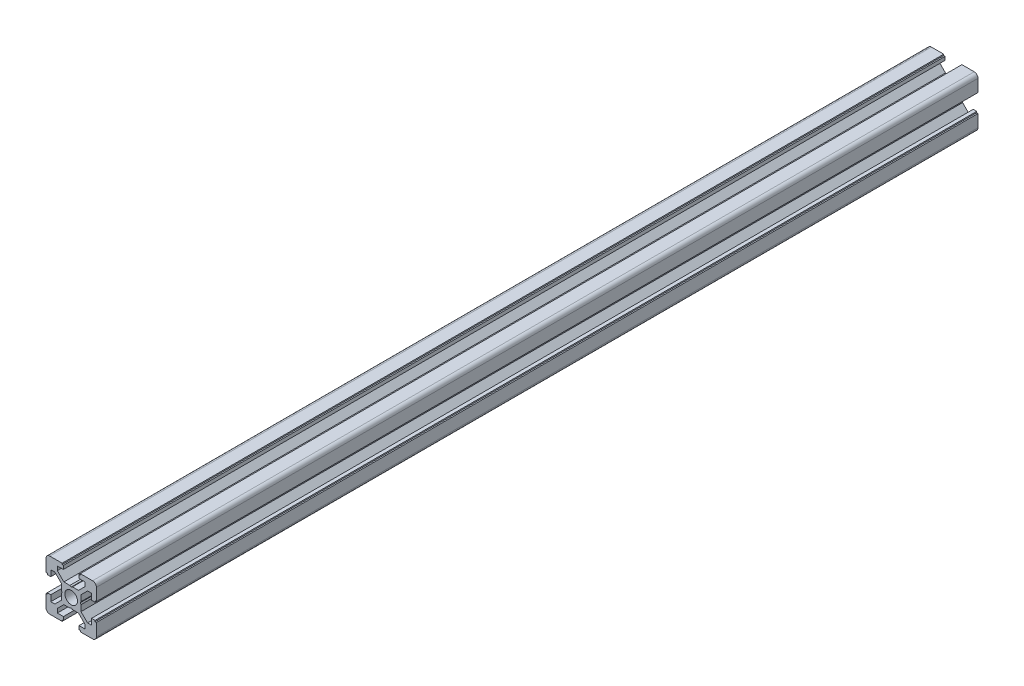
from build123d import *

# Parameters (mm, degrees)
SKETCH_28_R     = 2.5
EXTRUDE_1_DEPTH = 350


with BuildPart() as part:
    # 草图28 → 凸台-拉伸1 (new body)
    with BuildSketch(Plane.XY):
        with BuildLine():
            Line((-3.9, -0.519615242), (-3.9, -2.910050506))
            Line((-3.9, -2.910050506), (-6.489949494, -5.5))
            Line((-6.489949494, -5.5), (-8.1, -5.5))
            Line((-8.1, -5.5), (-8.1, -3.1))
            Line((-8.1, -3.1), (-9.5, -3.1))
            Line((-9.5, -3.1), (-9.5, -3.6))
            Line((-9.5, -3.6), (-10, -3.6))
            Line((-10, -3.6), (-10, -8.5))
            ThreePointArc((-10, -8.5), (-9.560660172, -9.560660172), (-8.5, -10))
            Line((-8.5, -10), (-3.6, -10))
            Line((-3.6, -10), (-3.6, -9.5))
            Line((-3.6, -9.5), (-3.1, -9.5))
            Line((-3.1, -9.5), (-3.1, -8.1))
            Line((-3.1, -8.1), (-5.5, -8.1))
            Line((-5.5, -8.1), (-5.5, -6.489949494))
            Line((-5.5, -6.489949494), (-2.910050506, -3.9))
            Line((-2.910050506, -3.9), (-0.519615242, -3.9))
            Line((-0.519615242, -3.9), (0, -3.6))
            Line((0, -3.6), (0.519615242, -3.9))
            Line((0.519615242, -3.9), (2.910050506, -3.9))
            Line((2.910050506, -3.9), (5.5, -6.489949494))
            Line((5.5, -6.489949494), (5.5, -8.1))
            Line((5.5, -8.1), (3.1, -8.1))
            Line((3.1, -8.1), (3.1, -9.5))
            Line((3.1, -9.5), (3.6, -9.5))
            Line((3.6, -9.5), (3.6, -10))
            Line((3.6, -10), (8.5, -10))
            ThreePointArc((8.5, -10), (9.560660172, -9.560660172), (10, -8.5))
            Line((10, -8.5), (10, -3.6))
            Line((10, -3.6), (9.5, -3.6))
            Line((9.5, -3.6), (9.5, -3.1))
            Line((9.5, -3.1), (8.1, -3.1))
            Line((8.1, -3.1), (8.1, -5.5))
            Line((8.1, -5.5), (6.489949494, -5.5))
            Line((6.489949494, -5.5), (3.9, -2.910050506))
            Line((3.9, -2.910050506), (3.9, -0.519615242))
            Line((3.9, -0.519615242), (3.6, 0))
            Line((3.6, 0), (3.9, 0.519615242))
            Line((3.9, 0.519615242), (3.9, 2.910050506))
            Line((3.9, 2.910050506), (6.489949494, 5.5))
            Line((6.489949494, 5.5), (8.1, 5.5))
            Line((8.1, 5.5), (8.1, 3.1))
            Line((8.1, 3.1), (9.5, 3.1))
            Line((9.5, 3.1), (9.5, 3.6))
            Line((9.5, 3.6), (10, 3.6))
            Line((10, 3.6), (10, 8.5))
            ThreePointArc((10, 8.5), (9.560660172, 9.560660172), (8.5, 10))
            Line((8.5, 10), (3.6, 10))
            Line((3.6, 10), (3.6, 9.5))
            Line((3.6, 9.5), (3.1, 9.5))
            Line((3.1, 9.5), (3.1, 8.1))
            Line((3.1, 8.1), (5.5, 8.1))
            Line((5.5, 8.1), (5.5, 6.489949494))
            Line((5.5, 6.489949494), (2.910050506, 3.9))
            Line((2.910050506, 3.9), (0.519615242, 3.9))
            Line((0.519615242, 3.9), (0, 3.6))
            Line((0, 3.6), (-0.519615242, 3.9))
            Line((-0.519615242, 3.9), (-2.910050506, 3.9))
            Line((-2.910050506, 3.9), (-5.5, 6.489949494))
            Line((-5.5, 6.489949494), (-5.5, 8.1))
            Line((-5.5, 8.1), (-3.1, 8.1))
            Line((-3.1, 8.1), (-3.1, 9.5))
            Line((-3.1, 9.5), (-3.6, 9.5))
            Line((-3.6, 9.5), (-3.6, 10))
            Line((-3.6, 10), (-8.5, 10))
            ThreePointArc((-8.5, 10), (-9.560660172, 9.560660172), (-10, 8.5))
            Line((-10, 8.5), (-10, 3.6))
            Line((-10, 3.6), (-9.5, 3.6))
            Line((-9.5, 3.6), (-9.5, 3.1))
            Line((-9.5, 3.1), (-8.1, 3.1))
            Line((-8.1, 3.1), (-8.1, 5.5))
            Line((-8.1, 5.5), (-6.489949494, 5.5))
            Line((-6.489949494, 5.5), (-3.9, 2.910050506))
            Line((-3.9, 2.910050506), (-3.9, 0.519615242))
            Line((-3.9, 0.519615242), (-3.6, 0))
            Line((-3.6, 0), (-3.9, -0.519615242))
        make_face()
        Circle(SKETCH_28_R, mode=Mode.SUBTRACT)
    extrude(amount=EXTRUDE_1_DEPTH)


solid = part.part
